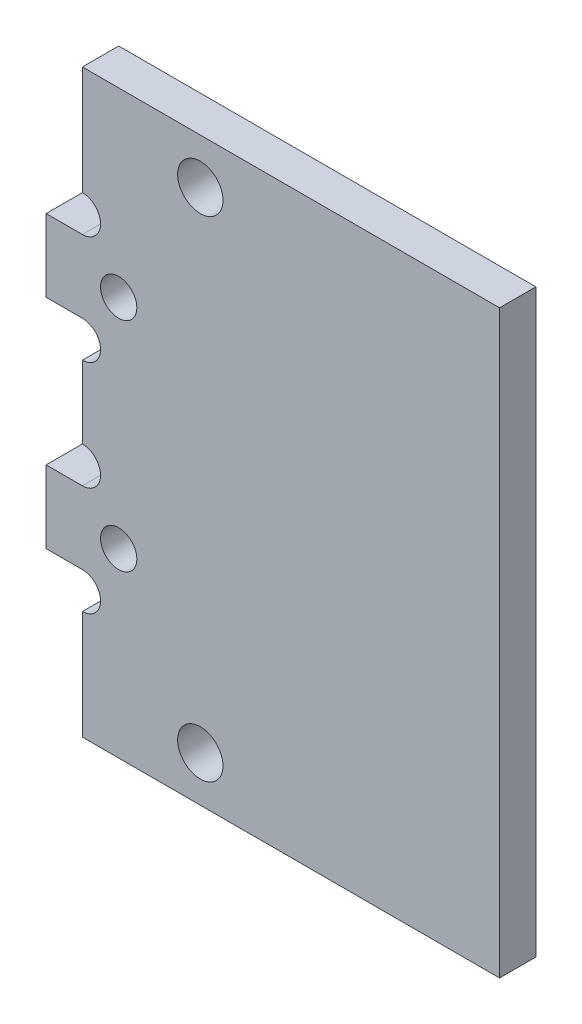
from build123d import *

# Parameters (mm, degrees)
SKETCH_1_R          = 1.25
SKETCH_1_R_2        = 1
EXTRUDE_1_DEPTH     = 2
SKETCH_4_W          = 15.5
SKETCH_4_H          = 22
CUT_EXTRUDE_1_DEPTH = 2
FILLET_2_R          = 2.5
FILLET_3_R          = 5
SKETCH_6_W          = 16
SKETCH_6_H          = 32
CUT_EXTRUDE_3_DEPTH = 10


with BuildPart() as part:
    # 草圖1 → 填料-伸長1 (new body)
    with BuildSketch(Plane.XY):
        with BuildLine():
            Line((-17.216213198, 10.1625), (13.283786802, 10.1625))
            Line((13.283786802, 10.1625), (13.283786802, -21.8375))
            Line((13.283786802, -21.8375), (-17.216213198, -21.8375))
            Line((-17.216213198, -21.8375), (-19.716213198, -21.8375))
            Line((-19.716213198, -21.8375), (-25.716213198, -21.8375))
            Line((-25.716213198, -21.8375), (-25.716213198, -15.8375))
            ThreePointArc((-25.716213198, -15.8375), (-24.716213198, -14.8375), (-25.716213198, -13.8375))
            Line((-25.716213198, -13.8375), (-27.716213198, -13.8375))
            Line((-27.716213198, -13.8375), (-27.716213198, -9.8375))
            Line((-27.716213198, -9.8375), (-25.716213198, -9.8375))
            ThreePointArc((-25.716213198, -9.8375), (-24.716213198, -8.8375), (-25.716213198, -7.8375))
            Line((-25.716213198, -7.8375), (-25.716213198, -3.8375))
            ThreePointArc((-25.716213198, -3.8375), (-24.716213198, -2.8375), (-25.716213198, -1.8375))
            Line((-25.716213198, -1.8375), (-27.716213198, -1.8375))
            Line((-27.716213198, -1.8375), (-27.716213198, 2.1625))
            Line((-27.716213198, 2.1625), (-25.716213198, 2.1625))
            ThreePointArc((-25.716213198, 2.1625), (-24.716213198, 3.1625), (-25.716213198, 4.1625))
            Line((-25.716213198, 4.1625), (-25.716213198, 10.1625))
            Line((-25.716213198, 10.1625), (-21.716213198, 10.1625))
            Line((-21.716213198, 10.1625), (-17.216213198, 10.1625))
        make_face()
        with Locations((-19.216213198, 7.6625)):
            Circle(SKETCH_1_R, mode=Mode.SUBTRACT)
        with Locations((-19.216213198, -19.3375)):
            Circle(SKETCH_1_R, mode=Mode.SUBTRACT)
        with Locations((10.783786802, -19.3375)):
            Circle(SKETCH_1_R, mode=Mode.SUBTRACT)
        with Locations((10.783786802, 7.6625)):
            Circle(SKETCH_1_R, mode=Mode.SUBTRACT)
        with Locations((-23.716213198, -11.8375)):
            Circle(SKETCH_1_R_2, mode=Mode.SUBTRACT)
        with Locations((-23.716213198, 0.1625)):
            Circle(SKETCH_1_R_2, mode=Mode.SUBTRACT)
    extrude(amount=EXTRUDE_1_DEPTH)

    # 草圖4 → 除料-伸長1 (cut)
    with BuildSketch(Plane(origin=(0, 0, 0), x_dir=(-1, 0, 0), z_dir=(0, 0, -1))):
        with Locations((-5.533786802, -5.8375)):
            Rectangle(SKETCH_4_W, SKETCH_4_H)
    extrude(amount=-CUT_EXTRUDE_1_DEPTH, mode=Mode.SUBTRACT)

    # 圓角2
    fillet_2_edges = [part.edges().sort_by_distance(p)[0] for p in [
        (13.283786802, -16.8375, 1),
        (13.283786802, 5.1625, 1),
    ]]
    fillet(fillet_2_edges, radius=FILLET_2_R)

    # 圓角3
    fillet_3_edges = [part.edges().sort_by_distance(p)[0] for p in [
        (-2.216213198, 5.1625, 1),
        (-2.216213198, -16.8375, 1),
    ]]
    fillet(fillet_3_edges, radius=FILLET_3_R)

    # 草圖6 → 除料-伸長3 (cut)
    with BuildSketch(Plane(origin=(0, 0, 0), x_dir=(-1, 0, 0), z_dir=(0, 0, -1))):
        with Locations((-5.283786802, -5.8375)):
            Rectangle(SKETCH_6_W, SKETCH_6_H)
    extrude(amount=-CUT_EXTRUDE_3_DEPTH, mode=Mode.SUBTRACT)


solid = part.part
